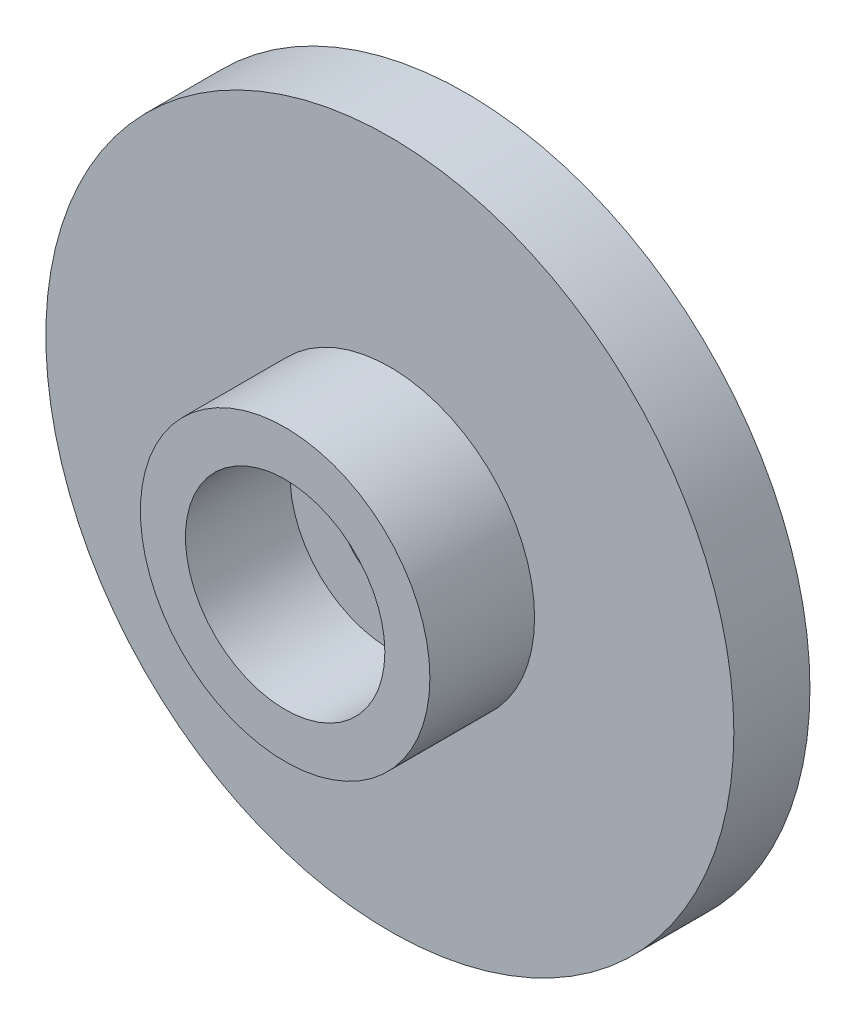
from build123d import *

# Parameters (mm, degrees)
SKETCH1_R           = 10.35
BOSS_EXTRUDE1_DEPTH = 2.29
SKETCH2_R           = 4.355
BOSS_EXTRUDE2_DEPTH = 3.15
SKETCH3_R           = 3
CUT_EXTRUDE1_DEPTH  = 3.15
SKETCH4_R           = 1.5
CUT_EXTRUDE2_DEPTH  = 2.29


with BuildPart() as part:
    # Sketch1 → Boss-Extrude1 (new body)
    with BuildSketch(Plane.XY):
        Circle(SKETCH1_R)
    extrude(amount=BOSS_EXTRUDE1_DEPTH)

    # Sketch2 → Boss-Extrude2 (add)
    with BuildSketch(Plane.XY.offset(2.29)):
        Circle(SKETCH2_R)
    extrude(amount=BOSS_EXTRUDE2_DEPTH)

    # Sketch3 → Cut-Extrude1 (cut)
    with BuildSketch(Plane.XY.offset(5.44)):
        Circle(SKETCH3_R)
    extrude(amount=-CUT_EXTRUDE1_DEPTH, mode=Mode.SUBTRACT)

    # Sketch4 → Cut-Extrude2 (cut)
    with BuildSketch(Plane.XY.offset(2.29)):
        Circle(SKETCH4_R)
    extrude(amount=-CUT_EXTRUDE2_DEPTH, mode=Mode.SUBTRACT)


solid = part.part
